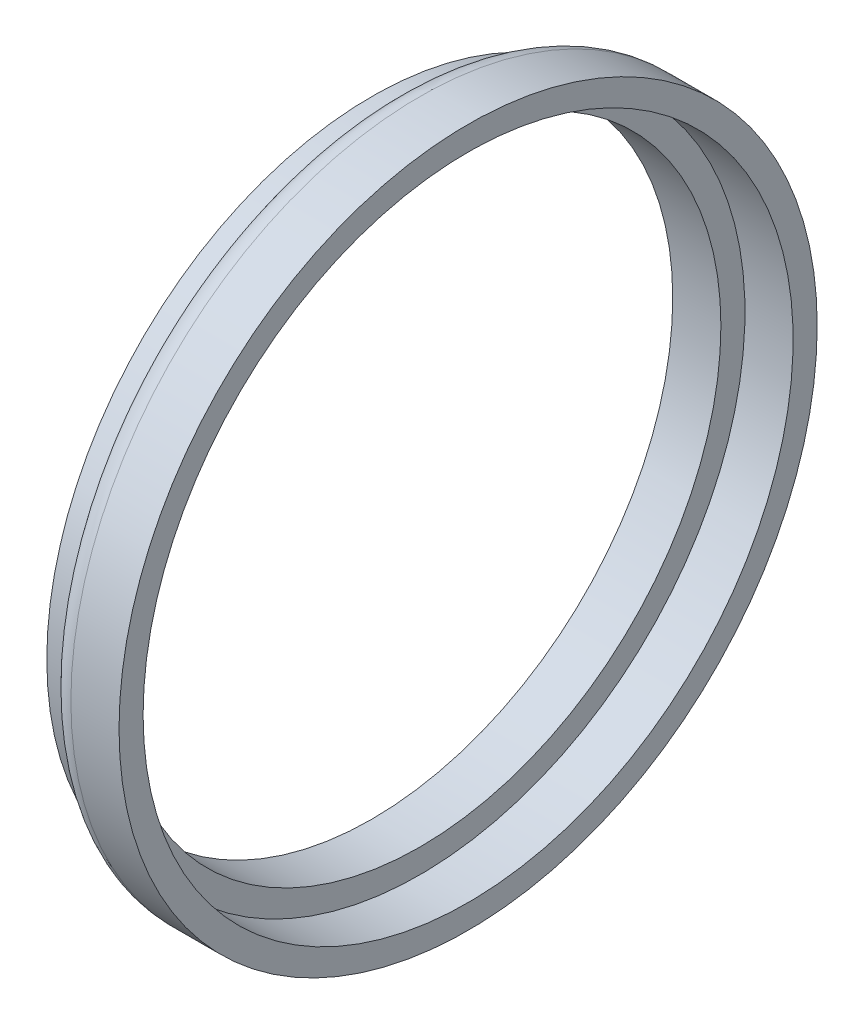
from build123d import *


with BuildPart() as part:
    # Sketch1 → Revolve1 (revolve)
    with BuildSketch(Plane.XY, mode=Mode.PRIVATE) as revolve1_sk:
        with BuildLine():
            Line((0, 18.415), (-2.54, 18.415))
            ThreePointArc((-2.54, 18.415), (-3.438025612, 18.043025612), (-3.81, 17.145))
            Line((-3.81, 17.145), (-5.08, 17.145))
            Line((-5.08, 17.145), (-5.08, 15.875))
            Line((-5.08, 15.875), (-2.54, 15.875))
            Line((-2.54, 15.875), (-2.54, 17.145))
            Line((-2.54, 17.145), (0, 17.145))
            Line((0, 17.145), (0, 18.415))
        make_face()
    revolve(revolve1_sk.sketch.rotate(Axis((-12.677099545, 0, 0), (1, 0, 0)), 90), axis=Axis((-12.677099545, 0, 0), (1, 0, 0)))


solid = part.part
